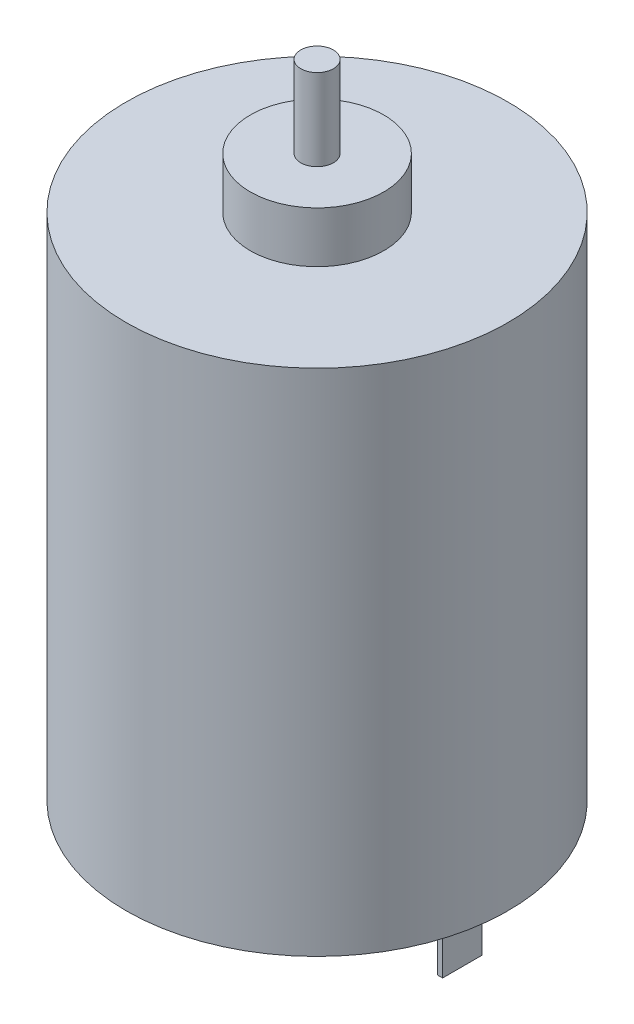
from build123d import *

# Parameters (mm, degrees)
SKETCH1_R           = 18.75
BOSS_EXTRUDE1_DEPTH = 50
SKETCH2_R           = 6.55
BOSS_EXTRUDE2_DEPTH = 5
SKETCH3_R           = 1.6
BOSS_EXTRUDE3_DEPTH = 8
SKETCH4_R           = 6.5
BOSS_EXTRUDE4_DEPTH = 2.5
SKETCH5_R           = 4
BOSS_EXTRUDE5_DEPTH = 1.3
SKETCH6_W           = 0.5
SKETCH6_H           = 3.85
BOSS_EXTRUDE6_DEPTH = 7


with BuildPart() as part:
    # Sketch1 → Boss-Extrude1 (new body)
    with BuildSketch(Plane(origin=(0, 0, 0), x_dir=(1, 0, 0), z_dir=(0, 1, 0))):
        with Locations(Location((0, 0, 0), (0, 0, 270))):
            Circle(SKETCH1_R)
    extrude(amount=BOSS_EXTRUDE1_DEPTH)

    # Sketch2 → Boss-Extrude2 (add)
    with BuildSketch(Plane(origin=(0, 50, 0), x_dir=(1, 0, 0), z_dir=(0, 1, 0))):
        with Locations(Location((0, 0, 0), (0, 0, 270))):
            Circle(SKETCH2_R)
    extrude(amount=BOSS_EXTRUDE2_DEPTH)

    # Sketch3 → Boss-Extrude3 (add)
    with BuildSketch(Plane(origin=(0, 55, 0), x_dir=(1, 0, 0), z_dir=(0, 1, 0))):
        with Locations(Location((0, 0, 0), (0, 0, 270))):
            Circle(SKETCH3_R)
    extrude(amount=BOSS_EXTRUDE3_DEPTH)

    # Sketch4 → Boss-Extrude4 (add)
    with BuildSketch(Plane.XZ):
        with Locations(Location((0, 0, 0), (0, 0, 90))):
            Circle(SKETCH4_R)
    extrude(amount=BOSS_EXTRUDE4_DEPTH)

    # Sketch5 → Boss-Extrude5 (add)
    with BuildSketch(Plane.XZ.offset(2.5)):
        with Locations(Location((0, 0, 0), (0, 0, 270))):
            Circle(SKETCH5_R)
    extrude(amount=BOSS_EXTRUDE5_DEPTH)

    # Sketch6 → Boss-Extrude6 (add)
    with BuildSketch(Plane.XZ):
        with Locations((-14, 0)):
            Rectangle(SKETCH6_W, SKETCH6_H)
        with Locations((14, 0)):
            Rectangle(SKETCH6_W, SKETCH6_H)
    extrude(amount=BOSS_EXTRUDE6_DEPTH)


solid = part.part
